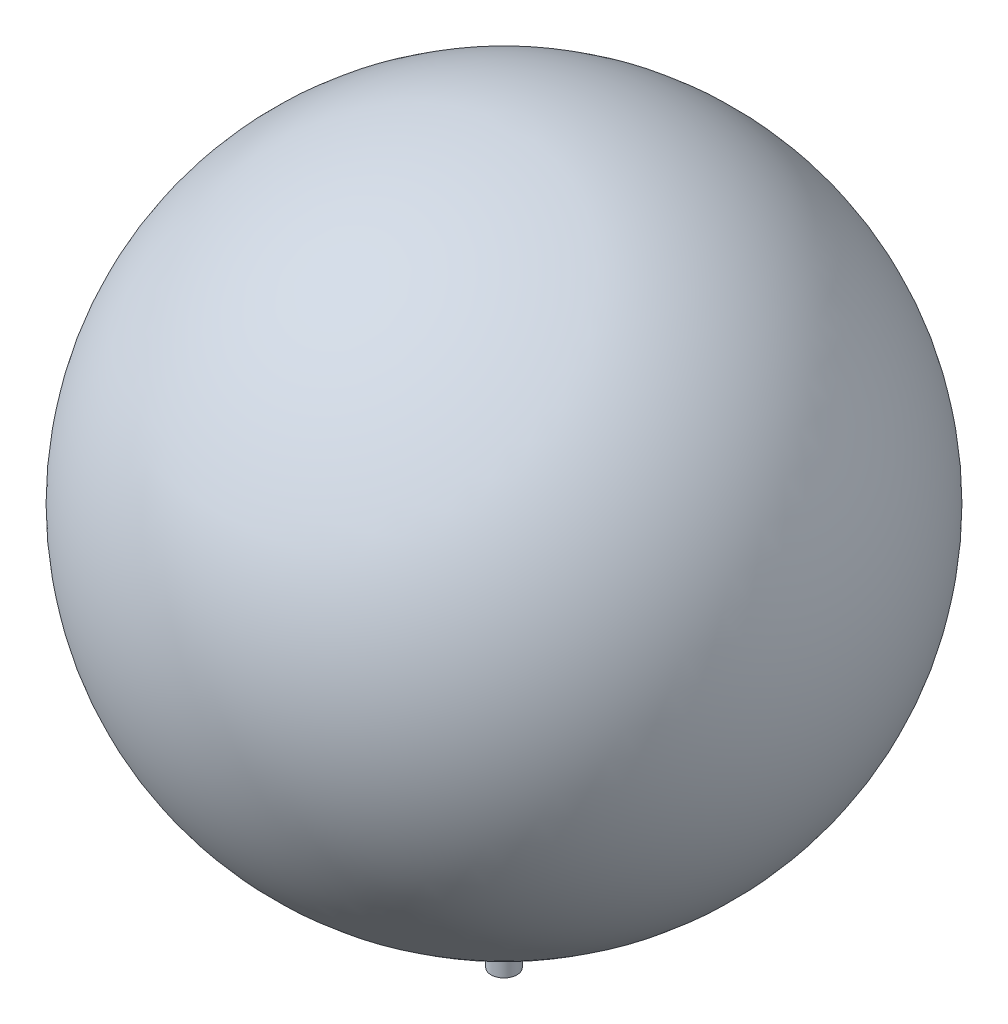
from build123d import *

# Parameters (mm, degrees)
SKETCH2_R           = 1
BOSS_EXTRUDE1_DEPTH = 6


with BuildPart() as part:
    # Sketch1 → Revolve1 (revolve)
    with BuildSketch(Plane.XY):
        with BuildLine():
            Line((0, 0), (0, 50))
            ThreePointArc((0, 50), (25, 25), (0, 0))
        make_face()
    revolve(axis=Axis((0, 0, 0), (0, 1, 0)))


with BuildPart() as body_2:
    # Sketch2 → Boss-Extrude1 (new body)
    with BuildSketch(Plane(origin=(0, 0, 0), x_dir=(1, 0, 0), z_dir=(0, 1, 0))):
        with Locations(Location((0, 0, 0), (0, 0, 270))):
            Circle(SKETCH2_R)
    extrude(amount=-BOSS_EXTRUDE1_DEPTH)


solid = Compound([part.part, body_2.part])
